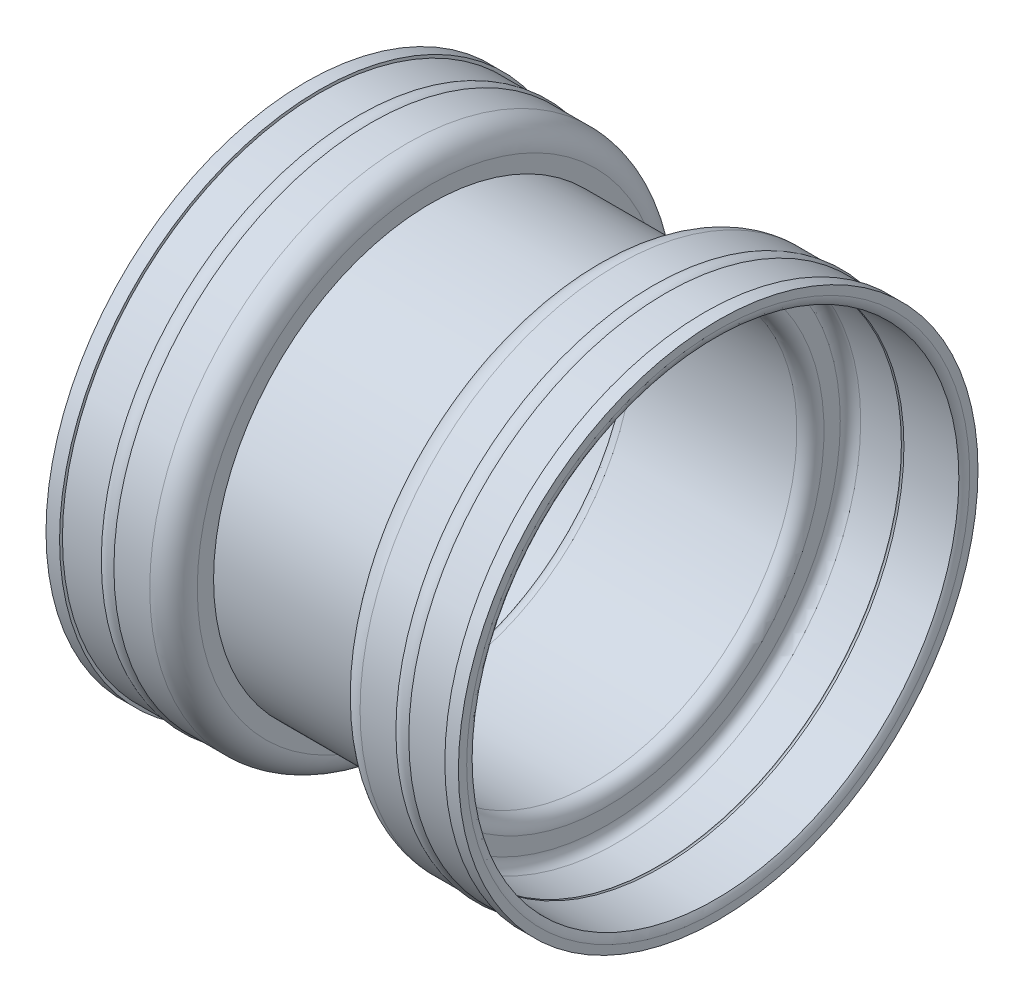
from build123d import *


with BuildPart() as part:
    # Szkic1 → Obrót-cienka ścianka1 (revolve)
    with BuildSketch(Plane.XY, mode=Mode.PRIVATE) as obr_t_cienka_cianka1_sk:
        with BuildLine():
            Line((0, 150), (-60, 150))
            ThreePointArc((-60, 150), (-67.071067812, 152.928932188), (-70, 160))
            Line((-70, 160), (-70, 172))
            ThreePointArc((-70, 172), (-72.202612014, 177.317575796), (-77.52018781, 179.52018781))
            Line((-77.52018781, 179.52018781), (-107.52018781, 179.52018781))
            ThreePointArc((-107.52018781, 179.52018781), (-108.577621971, 180.518537106), (-109.513590444, 179.405509102))
            Line((-109.513590444, 179.405509102), (-150, 179.405509102))
            ThreePointArc((-150, 179.405509102), (-151.486832981, 182.243231441), (-152, 185.405509102))
            Line((-152, 185.405509102), (-152, 191.52018781))
            Line((-152, 191.52018781), (-142, 191.52018781))
            Line((-142, 191.52018781), (-142, 189.405509102))
            Line((-142, 189.405509102), (-113.345166873, 189.405509102))
            ThreePointArc((-113.345166873, 189.405509102), (-108.654268568, 190.519370614), (-103.937612115, 189.52018781))
            Line((-103.937612115, 189.52018781), (-77.52018781, 189.52018781))
            ThreePointArc((-77.52018781, 189.52018781), (-65.131544202, 184.388643608), (-60, 172))
            Line((-60, 172), (-60, 160))
            Line((-60, 160), (0, 160))
            Line((0, 160), (0, 150))
        make_face()
    revolve(obr_t_cienka_cianka1_sk.sketch.rotate(Axis((0, 0, 0), (1, 0, 0)), 90), axis=Axis((0, 0, 0), (1, 0, 0)))

    # Lustro4: part across plane


with BuildPart() as part_1:
    add(part.part)
    add(part.part.mirror(Plane(origin=(0, 160, 0), x_dir=(0, 0, 1), z_dir=(1, 0, 0))))


solid = part_1.part
